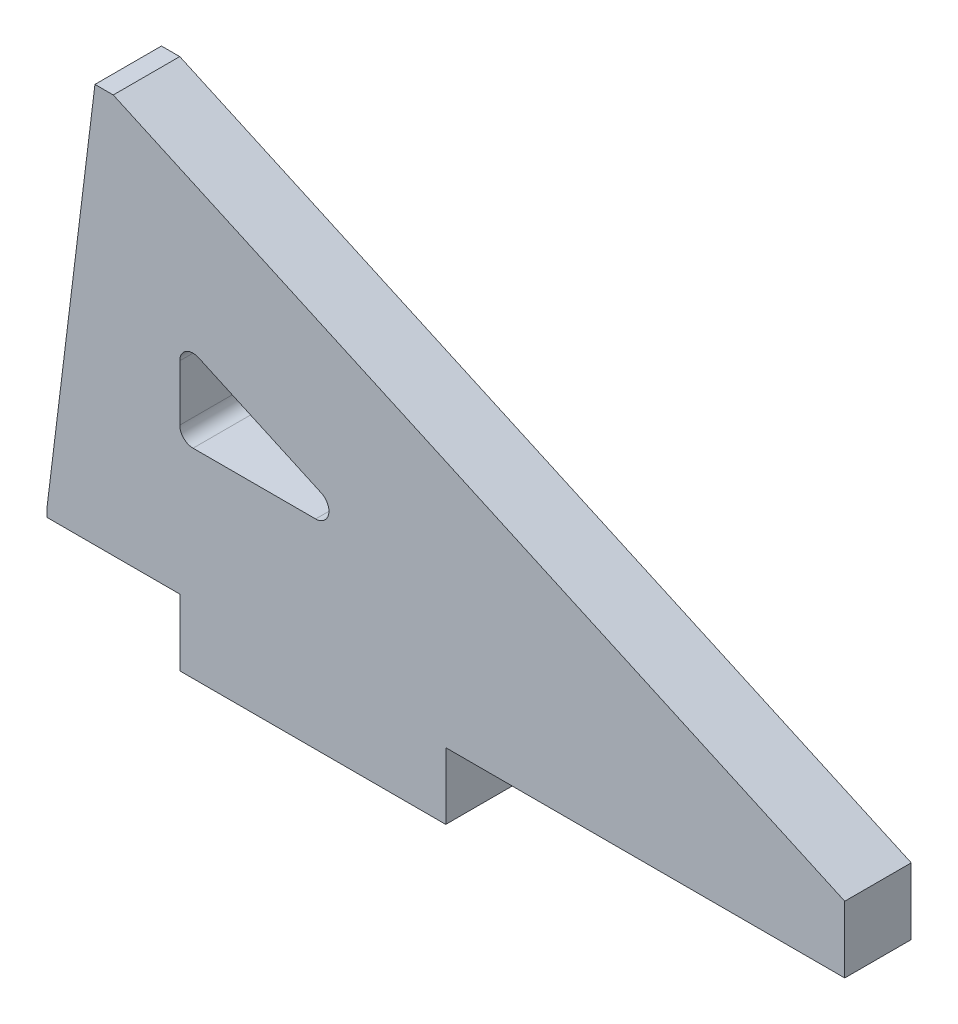
from build123d import *

# Parameters (mm, degrees)
BOSS_EXTRUDE1_DEPTH = 6.35
CUT_EXTRUDE1_DEPTH  = 78.771299333


with BuildPart() as part:
    # Sketch2 → Boss-Extrude1 (new body)
    with BuildSketch(Plane.XY):
        Polygon((0, 0), (0, 6.35), (-12.7, 6.35), (-12.7, 44.45), (-6.35, 44.45), (63.5, 12.7), (63.5, 6.35), (25.4, 6.35), (25.4, 0), align=None)
        with BuildLine():
            Line((0, 25.64089525), (0, 20.32))
            ThreePointArc((0, 20.32), (0.371974388, 19.421974388), (1.27, 19.05))
            Line((1.27, 19.05), (12.97596955, 19.05))
            ThreePointArc((12.97596955, 19.05), (14.217184699, 20.051141386), (13.501499289, 21.476165426))
            Line((13.501499289, 21.476165426), (1.795529739, 26.797060676))
            ThreePointArc((1.795529739, 26.797060676), (0.5824401, 26.708678648), (0, 25.64089525))
        make_face(mode=Mode.SUBTRACT)
    extrude(amount=BOSS_EXTRUDE1_DEPTH)

    # Sketch3 → Cut-Extrude1 (cut, through all)
    with BuildSketch(Plane.XY.offset(6.35)):
        Polygon((-8.09810823, 44.45), (-12.7, 6.970599198), (-12.7, 44.45), align=None)
    extrude(amount=-CUT_EXTRUDE1_DEPTH, mode=Mode.SUBTRACT)


solid = part.part
